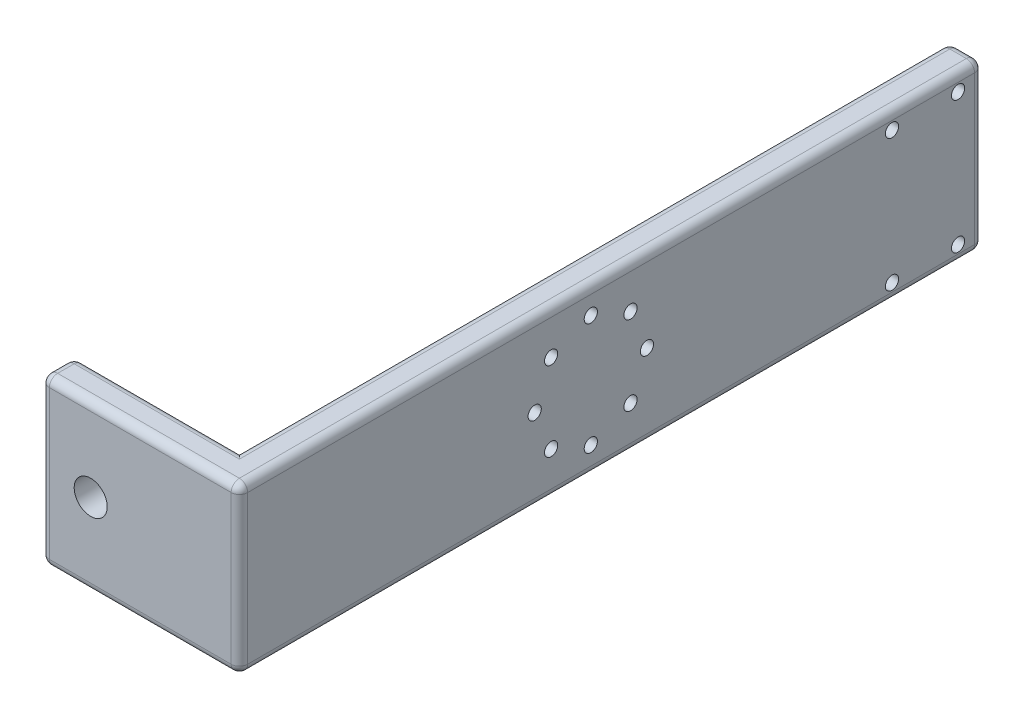
from build123d import *

# Parameters (mm, degrees)
BOSS_EXTRUDE1_DEPTH     = 100
CUT_EXTRUDE2_DEPTH      = 467.261729075
CUT_EXTRUDE2_DEPTH_BACK = 467.261729075
SKETCH4_R               = 10
FILLET1_R               = 5
SKETCH5_R               = 4
CUT_EXTRUDE3_DEPTH      = 15
SKETCH6_R               = 4
CUT_EXTRUDE4_DEPTH      = 20
SKETCH7_R               = 3
CUT_EXTRUDE5_DEPTH      = 13


with BuildPart() as part:
    # Sketch1 → Boss-Extrude1 (new body)
    with BuildSketch(Plane(origin=(0, 0, 0), x_dir=(1, 0, 0), z_dir=(0, 1, 0))):
        Polygon((50, 20), (50, 450), (70, 450), (70, 0), (-50, 0), (-50, 20), align=None)
    extrude(amount=BOSS_EXTRUDE1_DEPTH)

    # Sketch4 → Cut-Extrude2 (cut, two sides: drawn at the far end of the back side and taken through both)
    with BuildSketch(Plane.XY.offset(-CUT_EXTRUDE2_DEPTH_BACK)):
        with Locations((-20, 50)):
            Circle(SKETCH4_R)
    extrude(amount=CUT_EXTRUDE2_DEPTH + CUT_EXTRUDE2_DEPTH_BACK, mode=Mode.SUBTRACT)

    # Fillet1
    fillet1_edges = [part.edges().sort_by_distance(p)[0] for p in [
        (-50, 50, 0),
        (-50, 50, -20),
        (50, 50, -450),
        (70, 50, -450),
        (70, 50, 0),
        (60, 100, -450),
        (50, 100, -235),
        (0, 100, -20),
        (-50, 100, -10),
        (10, 100, 0),
        (-50, 0, -10),
        (0, 0, -20),
        (50, 0, -235),
        (60, 0, -450),
        (70, 0, -225),
        (10, 0, 0),
        (70, 100, -225),
    ]]
    fillet(fillet1_edges, radius=FILLET1_R)

    # Sketch5 → Cut-Extrude3 (cut)
    with BuildSketch(Plane(origin=(70, 0, 0), x_dir=(0, 0, -1), z_dir=(1, 0, 0))):
        with Locations((212.7, 83.970575503)):
            Circle(SKETCH5_R)
        with Locations((236.720824299, 74.020824299)):
            Circle(SKETCH5_R)
        with Locations((246.670575503, 50)):
            Circle(SKETCH5_R)
        with Locations((236.720824299, 25.979175701)):
            Circle(SKETCH5_R)
        with Locations((212.7, 16.029424497)):
            Circle(SKETCH5_R)
        with Locations((188.679175701, 25.979175701)):
            Circle(SKETCH5_R)
        with Locations((178.729424497, 50)):
            Circle(SKETCH5_R)
        with Locations((188.679175701, 74.020824299)):
            Circle(SKETCH5_R)
    extrude(amount=-CUT_EXTRUDE3_DEPTH, mode=Mode.SUBTRACT)

    # Sketch6 → Cut-Extrude4 (cut)
    with BuildSketch(Plane(origin=(70, 0, 0), x_dir=(0, 0, -1), z_dir=(1, 0, 0))):
        with Locations((395, 10)):
            Circle(SKETCH6_R)
        with Locations((435, 10)):
            Circle(SKETCH6_R)
        with Locations((435, 90)):
            Circle(SKETCH6_R)
        with Locations((395, 90)):
            Circle(SKETCH6_R)
    extrude(amount=-CUT_EXTRUDE4_DEPTH, mode=Mode.SUBTRACT)

    # Sketch7 → Cut-Extrude5 (cut)
    with BuildSketch(Plane.ZY.offset(-50)):
        with Locations((-363.04375, 72.225)):
            Circle(SKETCH7_R)
        with Locations((-328.11875, 72.225)):
            Circle(SKETCH7_R)
        with Locations((-363.04375, 27.775)):
            Circle(SKETCH7_R)
        with Locations((-328.11875, 27.775)):
            Circle(SKETCH7_R)
    extrude(amount=-CUT_EXTRUDE5_DEPTH, mode=Mode.SUBTRACT)


solid = part.part
